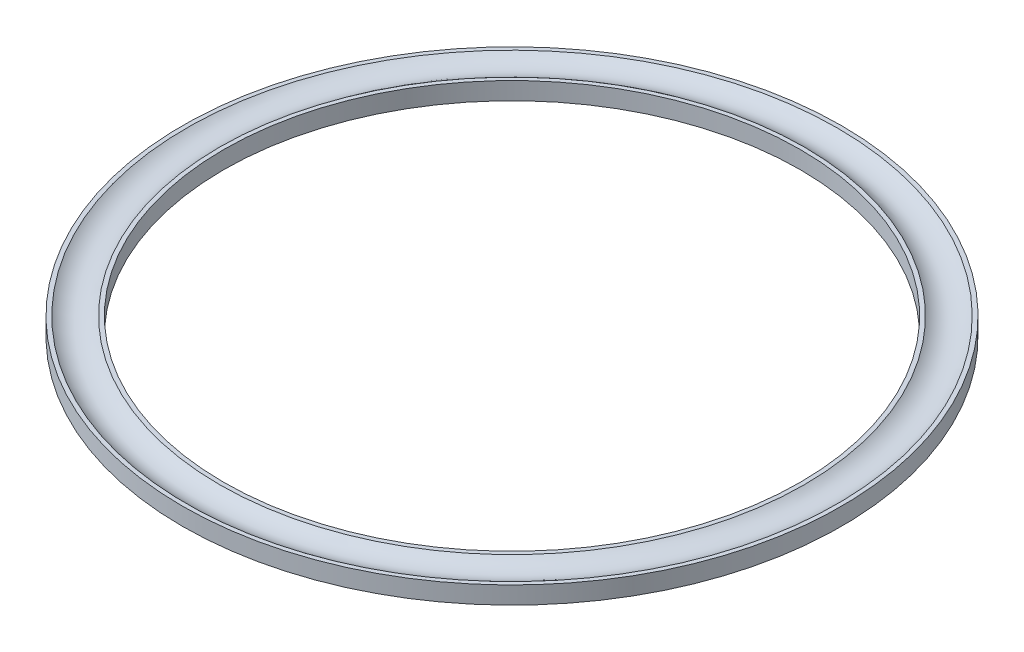
from build123d import *


with BuildPart() as part:
    # Sketch1 → Revolve2 (revolve)
    with BuildSketch(Plane.XY, mode=Mode.PRIVATE) as revolve2_sk:
        with BuildLine():
            Line((23.9141, -0.635), (23.9141, 0.635))
            Line((23.9141, 0.635), (23.61438, 0.635))
            ThreePointArc((23.61438, 0.635), (22.4155, 0.19304), (21.21662, 0.635))
            Line((21.21662, 0.635), (20.9169, 0.635))
            Line((20.9169, 0.635), (20.9169, -0.635))
            Line((20.9169, -0.635), (23.9141, -0.635))
        make_face()
    revolve(revolve2_sk.sketch.rotate(Axis((0, -11.412625366, 0), (0, 1, 0)), 90), axis=Axis((0, -11.412625366, 0), (0, 1, 0)))


solid = part.part
